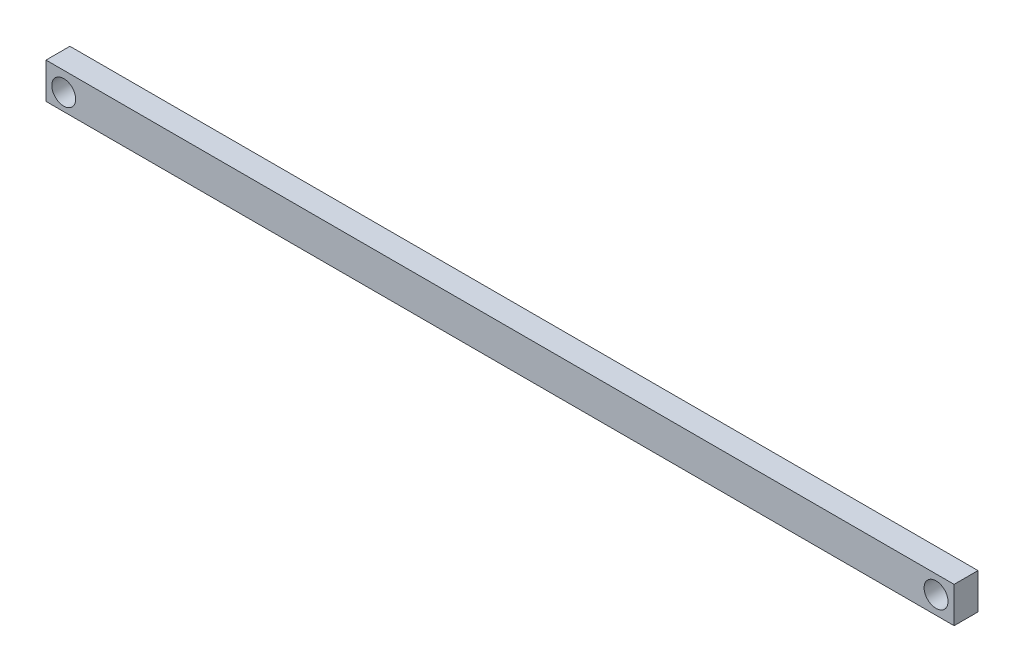
from build123d import *

# Parameters (mm, degrees)
SKETCH_1_W          = 380
SKETCH_1_H          = 15
EXTRUDE_1_DEPTH     = 10
SKETCH_2_R          = 5
CUT_EXTRUDE_1_DEPTH = 298.431673828


with BuildPart() as part:
    # 草图1 → 凸台-拉伸1 (new body)
    with BuildSketch(Plane.XY):
        with Locations((106.376794181, 15.443331659)):
            Rectangle(SKETCH_1_W, SKETCH_1_H)
    extrude(amount=EXTRUDE_1_DEPTH)

    # 草图2 → 切除-拉伸1 (cut, through all)
    with BuildSketch(Plane.XY.offset(10)):
        with Locations((-76.199169982, 14.957349386)):
            Circle(SKETCH_2_R)
        with Locations((288.824182166, 15.443331659)):
            Circle(SKETCH_2_R)
    extrude(amount=-CUT_EXTRUDE_1_DEPTH, mode=Mode.SUBTRACT)


solid = part.part
